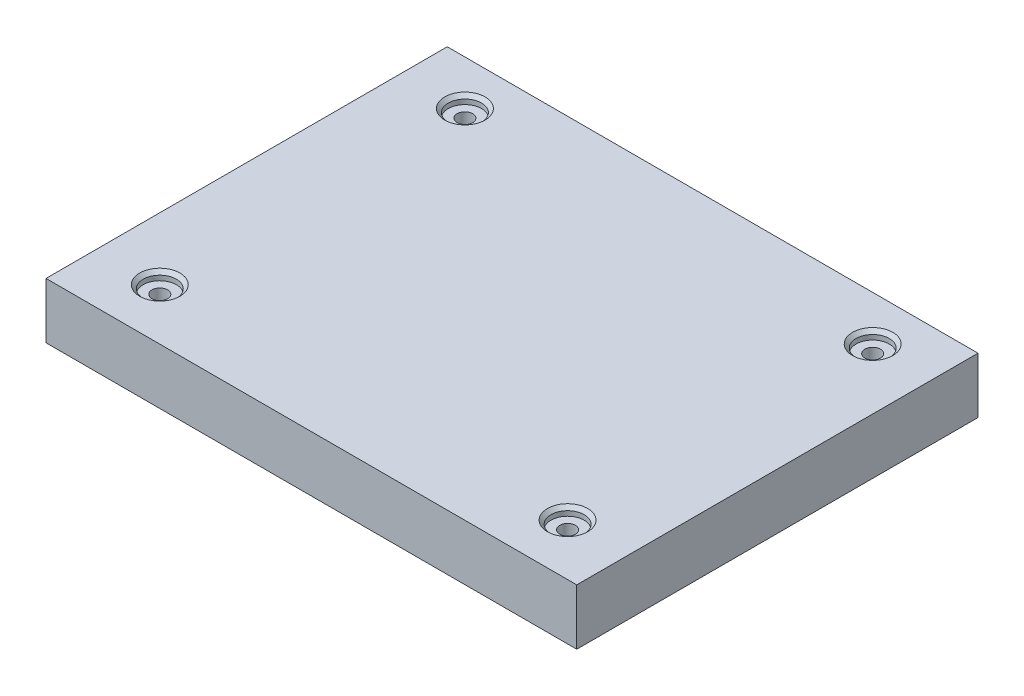
from build123d import *

# Parameters (mm, degrees)
SKETCH1_W                                   = 95.169284227
SKETCH1_H                                   = 71.949644858
BOSS_EXTRUDE1_DEPTH                         = 10
CBORE_FOR_3_BINDING_HEAD_MACHINE_SC_2_COUNT = 2
CBORE_FOR_3_BINDING_HEAD_MACHINE_SC_2_PITCH = 54.707018707
CBORE_FOR_3_BINDING_HEAD_MACHINE_SC_3_COUNT = 2
CBORE_FOR_3_BINDING_HEAD_MACHINE_SC_3_PITCH = 73.126317411
CBORE_FOR_3_BINDING_HEAD_MACHINE_SC_4_COUNT = 2
CBORE_FOR_3_BINDING_HEAD_MACHINE_SC_4_PITCH = 91.332818695


with BuildPart() as part:
    # Sketch1 → Boss-Extrude1 (new body)
    with BuildSketch(Plane(origin=(0, 0, 0), x_dir=(1, 0, 0), z_dir=(0, 1, 0))):
        with Locations((47.584642114, 35.974822429)):
            Rectangle(SKETCH1_W, SKETCH1_H)
    extrude(amount=BOSS_EXTRUDE1_DEPTH)

    # Sketch3 → CBORE for #3 Binding Head Machine Screw1 (revolve, cut)
    with BuildSketch(Plane(origin=(11.17, 10, -63.944240186), x_dir=(0, 0, 1), z_dir=(1, 0, 0))):
        Polygon((0, 0), (0, 10), (1.397, 10), (1.397, 1.4986), (2.97688, 1.4986), (2.97688, 0.635), (3.61188, 0), align=None)
    cbore_for_3_binding_head_machine_screw1 = revolve(axis=Axis((11.17, 16.35, -63.944240186), (0, -1, 0)), mode=Mode.SUBTRACT)

    # CBORE for _3 Binding Head Machine Sc 2: CBORE for #3 Binding Head Machine Screw1 ×2
    with Locations(*[(0, 0, i * CBORE_FOR_3_BINDING_HEAD_MACHINE_SC_2_PITCH) for i in range(1, CBORE_FOR_3_BINDING_HEAD_MACHINE_SC_2_COUNT)]):
        add(cbore_for_3_binding_head_machine_screw1, mode=Mode.SUBTRACT)

    # CBORE for _3 Binding Head Machine Sc 3: CBORE for #3 Binding Head Machine Screw1 ×2
    with Locations(*[Vector(0.9999999980255075, 0, 6.284095007611635e-05) * (i * CBORE_FOR_3_BINDING_HEAD_MACHINE_SC_3_PITCH) for i in range(1, CBORE_FOR_3_BINDING_HEAD_MACHINE_SC_3_COUNT)]):
        add(cbore_for_3_binding_head_machine_screw1, mode=Mode.SUBTRACT)

    # CBORE for _3 Binding Head Machine Sc 4: CBORE for #3 Binding Head Machine Screw1 ×2
    with Locations(*[Vector(0.8006979380692495, 0, 0.5990682865681111) * (i * CBORE_FOR_3_BINDING_HEAD_MACHINE_SC_4_PITCH) for i in range(1, CBORE_FOR_3_BINDING_HEAD_MACHINE_SC_4_COUNT)]):
        add(cbore_for_3_binding_head_machine_screw1, mode=Mode.SUBTRACT)


solid = part.part
